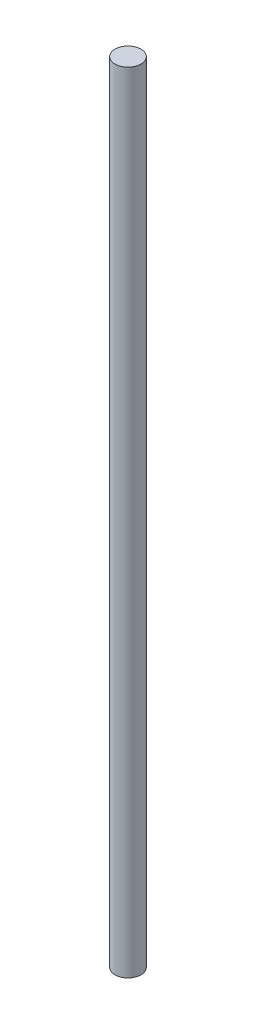
from build123d import *

# Parameters (mm, degrees)
SKETCH1_R           = 0.625
BOSS_EXTRUDE1_DEPTH = 38


with BuildPart() as part:
    # Sketch1 → Boss-Extrude1 (new body)
    with BuildSketch(Plane(origin=(0, 0, 0), x_dir=(1, 0, 0), z_dir=(0, 1, 0))):
        with Locations(Location((0, 0, 0), (0, 0, 270))):
            Circle(SKETCH1_R)
    extrude(amount=BOSS_EXTRUDE1_DEPTH)


solid = part.part
